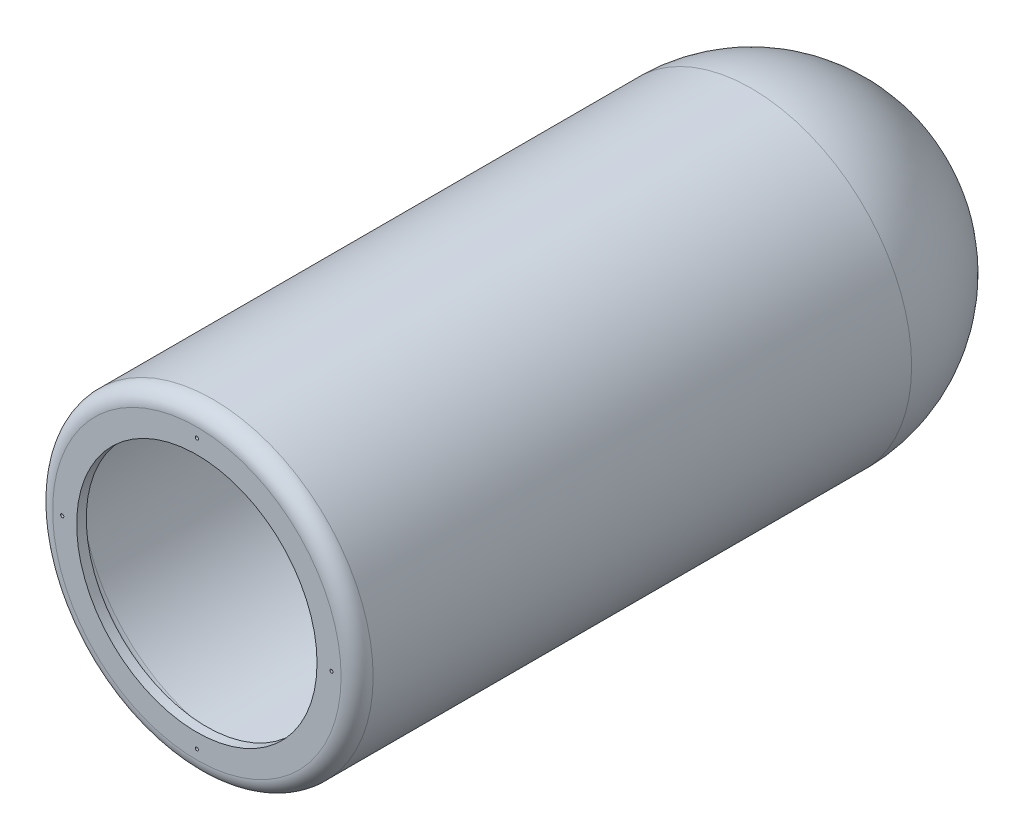
from build123d import *

# Parameters (mm, degrees)
SKETCH1_R           = 50
BOSS_EXTRUDE1_DEPTH = 3
SKETCH2_R           = 37.5
CUT_EXTRUDE1_DEPTH  = 4
BOSS_EXTRUDE2_START = 170
SKETCH3_R           = 50
SKETCH3_R_2         = 47
BOSS_EXTRUDE2_DEPTH = 170
FILLET1_R           = 8
REVOLVE4_ANGLE      = 180
SKETCH5_R           = 0.5
CUT_EXTRUDE2_DEPTH  = 3
SKETCH6_R           = 1.5
CUT_EXTRUDE3_DEPTH  = 234.942300579
FILLET2_R           = 5


with BuildPart() as part:
    # Sketch1 → Boss-Extrude1 (new body)
    with BuildSketch(Plane.XY):
        Circle(SKETCH1_R)
    extrude(amount=BOSS_EXTRUDE1_DEPTH)

    # Sketch2 → Cut-Extrude1 (cut)
    with BuildSketch(Plane.XY.offset(3)):
        Circle(SKETCH2_R)
    extrude(amount=-CUT_EXTRUDE1_DEPTH, mode=Mode.SUBTRACT)

    # Sketch3 → Boss-Extrude2 (add)
    with BuildSketch(Plane(origin=(0, 0, 0), x_dir=(-1, 0, 0), z_dir=(0, 0, -1)).offset(BOSS_EXTRUDE2_START)):
        Circle(SKETCH3_R)
        Circle(SKETCH3_R_2, mode=Mode.SUBTRACT)
    extrude(amount=-BOSS_EXTRUDE2_DEPTH)

    # Fillet1
    fillet1_edges = [part.edges().sort_by_distance(p)[0] for p in [
        (47, 0, 0),
    ]]
    fillet(fillet1_edges, radius=FILLET1_R)

    # Sketch4 → Revolve4 (revolve)
    with BuildSketch(Plane(origin=(0, 0, -170), x_dir=(-1, 0, 0), z_dir=(0, 0, -1))):
        with BuildLine():
            Line((50, 0), (47, 0))
            ThreePointArc((47, 0), (0, 47), (-47, 0))
            Line((-47, 0), (-50, 0))
            ThreePointArc((-50, 0), (0, 50), (50, 0))
        make_face()
    revolve(axis=Axis((47, 0, -170), (-1, 0, 0)), revolution_arc=REVOLVE4_ANGLE)

    # Sketch5 → Cut-Extrude2 (cut)
    with BuildSketch(Plane.XY.offset(3)):
        with Locations((0, -42)):
            Circle(SKETCH5_R)
        with Locations((-42, 0)):
            Circle(SKETCH5_R)
        with Locations((0, 42)):
            Circle(SKETCH5_R)
        with Locations((42, 0)):
            Circle(SKETCH5_R)
    extrude(amount=-CUT_EXTRUDE2_DEPTH, mode=Mode.SUBTRACT)

    # Sketch6 → Cut-Extrude3 (cut, through all)
    with BuildSketch(Plane.XY.offset(3)):
        Circle(SKETCH6_R)
    extrude(amount=-CUT_EXTRUDE3_DEPTH, mode=Mode.SUBTRACT)

    # Fillet2
    fillet2_edges = [part.edges().sort_by_distance(p)[0] for p in [
        (-50, 0, 3),
    ]]
    fillet(fillet2_edges, radius=FILLET2_R)


solid = part.part
